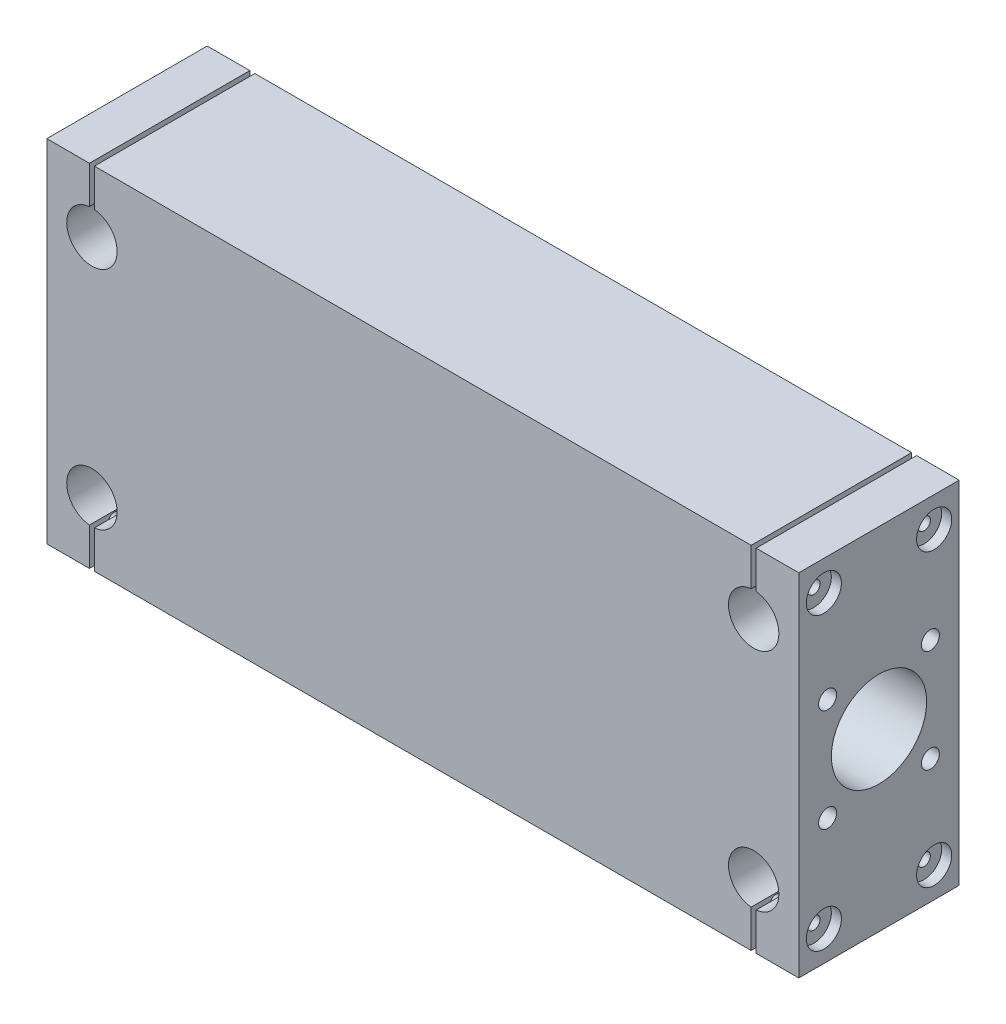
from build123d import *

# Parameters (mm, degrees)
SKETCH1_W                      = 150
SKETCH1_H                      = 70
BOSS_EXTRUDE1_DEPTH            = 32
SKETCH2_R                      = 9.5
LINEAR_BEARING_CUT_1_DEPTH     = 55
Y_AXIS_SHAFTS_CUT_DEPTH        = 169.594187326
LINEAR_BEARING_CUT_2_START     = -55
SKETCH7_R                      = 9.5
LINEAR_BEARING_CUT_2_DEPTH     = 55
SKETCH6_R                      = 6
BETWEEN_BEARINGS_DEPTH         = 123.266103234
SKETCH8_R                      = 3.5
SHAFT_HOLDER_SCREW_CUT_DEPTH   = 4
SKETCH9_R                      = 1.25
SHAFT_HOLDER_SCREW_CUT2_DEPTH  = 20
SHAFT_HOLDER_SCREW_CUT_3_START = -2
SKETCH10_R                     = 3.5
SHAFT_HOLDER_SCREW_CUT_3_DEPTH = 2
SHAFT_HOLDER_SCREW_CUT_4_START = -20
SKETCH11_R                     = 1.25
SHAFT_HOLDER_SCREW_CUT_4_DEPTH = 20
SKETCH12_R                     = 1.8
LINEAR_BEARING_SREW1_DEPTH     = 14
SKETCH13_R                     = 1.85
LINEAR_BEARING_SCREW2_DEPTH    = 14


with BuildPart() as part:
    # Sketch1 → Boss-Extrude1 (new body)
    with BuildSketch(Plane.XY):
        with Locations((-75, -35)):
            Rectangle(SKETCH1_W, SKETCH1_H)
    extrude(amount=BOSS_EXTRUDE1_DEPTH)

    # Sketch2 → Linear_bearing-cut-1 (cut)
    with BuildSketch(Plane.ZY.offset(150)):
        with Locations((16, -35)):
            Circle(SKETCH2_R)
    extrude(amount=-LINEAR_BEARING_CUT_1_DEPTH, mode=Mode.SUBTRACT)

    # Sketch5 → Y-axis-shafts-cut (cut, through all)
    with BuildSketch(Plane.XY.offset(32)):
        with BuildLine():
            Line((-141.5, 0), (-141.5, -7.5))
            ThreePointArc((-141.5, -7.5), (-141, -17.524937811), (-140.5, -7.5))
            Line((-140.5, -7.5), (-140.5, 0))
            Line((-140.5, 0), (-141.5, 0))
        make_face()
        with BuildLine():
            Line((-8.5, 0), (-8.5, -7.5))
            ThreePointArc((-8.5, -7.5), (-9, -17.524937811), (-9.5, -7.5))
            Line((-9.5, -7.5), (-9.5, 0))
            Line((-9.5, 0), (-8.5, 0))
        make_face()
        with BuildLine():
            Line((-141.5, -70), (-141.5, -62.5))
            ThreePointArc((-141.5, -62.5), (-141, -52.475062189), (-140.5, -62.5))
            Line((-140.5, -62.5), (-140.5, -70))
            Line((-140.5, -70), (-141.5, -70))
        make_face()
        with BuildLine():
            Line((-9.5, -70), (-9.5, -62.5))
            ThreePointArc((-9.5, -62.5), (-9, -52.475062189), (-8.5, -62.5))
            Line((-8.5, -62.5), (-8.5, -70))
            Line((-8.5, -70), (-9.5, -70))
        make_face()
    extrude(amount=-Y_AXIS_SHAFTS_CUT_DEPTH, mode=Mode.SUBTRACT)

    # Sketch7 → Linear-bearing-cut-2 (cut)
    with BuildSketch(Plane(origin=(0, 0, 0), x_dir=(0, 0, -1), z_dir=(1, 0, 0)).offset(LINEAR_BEARING_CUT_2_START)):
        with Locations(Location((-16, -35, 0), (0, 0, 180))):
            Circle(SKETCH7_R)
    extrude(amount=LINEAR_BEARING_CUT_2_DEPTH, mode=Mode.SUBTRACT)

    # Sketch6 → between-bearings (cut, through all)
    with BuildSketch(Plane.ZY.offset(95)):
        with Locations((16, -35)):
            Circle(SKETCH6_R)
    extrude(amount=-BETWEEN_BEARINGS_DEPTH, mode=Mode.SUBTRACT)

    # Sketch8 → shaft-holder-screw-cut (cut)
    with BuildSketch(Plane.ZY.offset(150)):
        with Locations((5, -6)):
            Circle(SKETCH8_R)
        with Locations(Location((27, -6, 0), (0, 0, 180))):
            Circle(SKETCH8_R)
        with Locations((27, -64)):
            Circle(SKETCH8_R)
        with Locations(Location((5, -64, 0), (0, 0, 180))):
            Circle(SKETCH8_R)
    extrude(amount=-SHAFT_HOLDER_SCREW_CUT_DEPTH, mode=Mode.SUBTRACT)

    # Sketch9 → shaft-holder-screw-cut2 (cut)
    with BuildSketch(Plane.ZY.offset(146)):
        with Locations((5, -6)):
            Circle(SKETCH9_R)
        with Locations((27, -6)):
            Circle(SKETCH9_R)
        with Locations((5, -64)):
            Circle(SKETCH9_R)
        with Locations((27, -64)):
            Circle(SKETCH9_R)
    extrude(amount=-SHAFT_HOLDER_SCREW_CUT2_DEPTH, mode=Mode.SUBTRACT)

    # Sketch10 → shaft-holder-screw-cut-3 (cut)
    with BuildSketch(Plane(origin=(0, 0, 0), x_dir=(0, 0, -1), z_dir=(1, 0, 0)).offset(SHAFT_HOLDER_SCREW_CUT_3_START)):
        with Locations((-27, -6)):
            Circle(SKETCH10_R)
        with Locations(Location((-5, -6, 0), (0, 0, 180))):
            Circle(SKETCH10_R)
        with Locations((-5, -64)):
            Circle(SKETCH10_R)
        with Locations(Location((-27, -64, 0), (0, 0, 180))):
            Circle(SKETCH10_R)
    extrude(amount=SHAFT_HOLDER_SCREW_CUT_3_DEPTH, mode=Mode.SUBTRACT)

    # Sketch11 → shaft-holder-screw-cut-4 (cut)
    with BuildSketch(Plane(origin=(-2, 0, 0), x_dir=(0, 0, -1), z_dir=(1, 0, 0)).offset(SHAFT_HOLDER_SCREW_CUT_4_START)):
        with Locations(Location((-27, -6, 0), (0, 0, 180))):
            Circle(SKETCH11_R)
        with Locations(Location((-5, -6, 0), (0, 0, 180))):
            Circle(SKETCH11_R)
        with Locations(Location((-5, -64, 0), (0, 0, 180))):
            Circle(SKETCH11_R)
        with Locations(Location((-27, -64, 0), (0, 0, 180))):
            Circle(SKETCH11_R)
    extrude(amount=SHAFT_HOLDER_SCREW_CUT_4_DEPTH, mode=Mode.SUBTRACT)

    # Sketch12 → Linear-bearing-srew1 (cut)
    with BuildSketch(Plane(origin=(0, 0, 0), x_dir=(0, 0, -1), z_dir=(1, 0, 0))):
        with Locations(Location((-5.75, -24.75, 0), (0, 0, 90))):
            Circle(SKETCH12_R)
        with Locations(Location((-26.25, -24.75, 0), (0, 0, 270))):
            Circle(SKETCH12_R)
        with Locations(Location((-5.75, -45.25, 0), (0, 0, 270))):
            Circle(SKETCH12_R)
        with Locations(Location((-26.25, -45.25, 0), (0, 0, 90))):
            Circle(SKETCH12_R)
    extrude(amount=-LINEAR_BEARING_SREW1_DEPTH, mode=Mode.SUBTRACT)

    # Sketch13 → Linear-bearing-screw2 (cut)
    with BuildSketch(Plane.ZY.offset(150)):
        with Locations(Location((27.5, -24.75, 0), (0, 0, 270))):
            Circle(SKETCH13_R)
        with Locations(Location((4.5, -24.75, 0), (0, 0, 90))):
            Circle(SKETCH13_R)
        with Locations(Location((27.5, -45.25, 0), (0, 0, 90))):
            Circle(SKETCH13_R)
        with Locations(Location((4.5, -45.25, 0), (0, 0, 270))):
            Circle(SKETCH13_R)
    extrude(amount=-LINEAR_BEARING_SCREW2_DEPTH, mode=Mode.SUBTRACT)


solid = part.part
